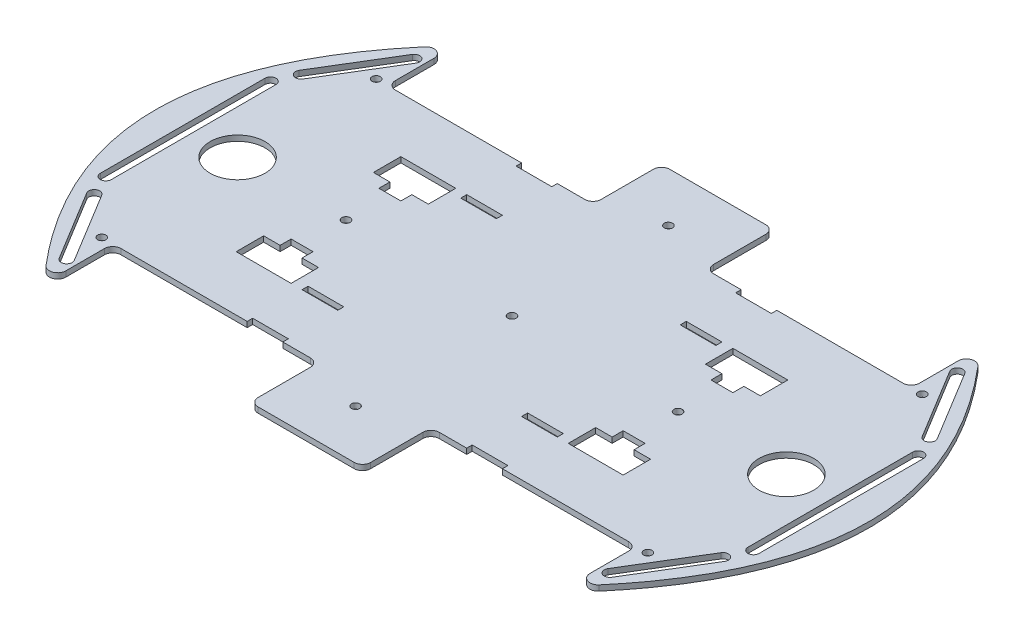
from build123d import *

# Parameters (mm, degrees)
SKETCH1_R           = 1.5
SKETCH1_W           = 13
SKETCH1_H           = 2.19615452
SKETCH1_R_2         = 10
BOSS_EXTRUDE1_DEPTH = 2
FILLET1_R           = 3


with BuildPart() as part:
    # Sketch1 → Boss-Extrude1 (new body)
    with BuildSketch(Plane(origin=(0, 0, 0), x_dir=(1, 0, 0), z_dir=(0, 1, 0))):
        with BuildLine():
            Line((-95.5, 69), (-95.5, 75))
            add(Edge.make_bspline(
                [(-95.5, 75), (-129.999999581, 37.500000455), (-130, 9.1e-07)],
                knots=[0, 0, 0, 0.499999994, 0.499999994, 0.499999994], degree=2))
            add(Edge.make_bspline(
                [(-130, 9.1e-07), (-130.000000419, -37.499999545), (-95.5, -75)],
                knots=[0.499999994, 0.499999994, 0.499999994, 1, 1, 1], degree=2))
            Line((-95.5, -75), (-95.5, -50))
            Line((-95.5, -50), (-46.5, -50))
            Line((-46.5, -50), (-46.5, -48))
            Line((-46.5, -48), (-33.5, -48))
            Line((-33.5, -48), (-33.5, -50))
            Line((-33.5, -50), (-20.5, -50))
            Line((-20.5, -50), (-20.5, -75))
            Line((-20.5, -75), (20.5, -75))
            Line((20.5, -75), (20.5, -50))
            Line((20.5, -50), (33.5, -50))
            Line((33.5, -50), (33.5, -48))
            Line((33.5, -48), (46.5, -48))
            Line((46.5, -48), (46.5, -50))
            Line((46.5, -50), (95.5, -50))
            Line((95.5, -50), (95.5, -75))
            add(Edge.make_bspline(
                [(130, 5.22e-07), (130.00000024, -37.499999739), (95.5, -75)],
                knots=[0.499999997, 0.499999997, 0.499999997, 1, 1, 1], degree=2))
            add(Edge.make_bspline(
                [(95.5, 75), (129.99999976, 37.500000261), (130, 5.22e-07)],
                knots=[0, 0, 0, 0.499999997, 0.499999997, 0.499999997], degree=2))
            Line((95.5, 75), (95.5, 50))
            Line((95.5, 50), (46.5, 50))
            Line((46.5, 50), (46.5, 48))
            Line((46.5, 48), (33.5, 48))
            Line((33.5, 48), (33.5, 50))
            Line((33.5, 50), (20.5, 50))
            Line((20.5, 50), (20.5, 75))
            Line((20.5, 75), (0, 75))
            Line((0, 75), (-20.5, 75))
            Line((-20.5, 75), (-20.5, 50))
            Line((-20.5, 50), (-33.5, 50))
            Line((-33.5, 50), (-33.5, 48))
            Line((-33.5, 48), (-46.5, 48))
            Line((-46.5, 48), (-46.5, 50))
            Line((-46.5, 50), (-95.5, 50))
            Line((-95.5, 50), (-95.5, 69))
        make_face()
        with BuildLine():
            Line((-100.665133807, -64.355482792), (-116.252551949, -38.722839626))
            ThreePointArc((-116.252551949, -38.722839626), (-115.58287028, -35.974835539), (-112.834866193, -36.644517208))
            Line((-112.834866193, -36.644517208), (-97.247448051, -62.277160374))
            ThreePointArc((-97.247448051, -62.277160374), (-97.91712972, -65.025164461), (-100.665133807, -64.355482792))
        make_face(mode=Mode.SUBTRACT)
        with Locations((-99.5, -50)):
            Circle(SKETCH1_R, mode=Mode.SUBTRACT)
        with Locations((-40, -28.90192274)):
            Rectangle(SKETCH1_W, SKETCH1_H, mode=Mode.SUBTRACT)
        Polygon((-56.5, -16), (-56.5, -20), (-50.5, -20), (-50.5, -30), (-70.5, -30), (-70.5, -20), (-64.5, -20), (-64.5, -16), align=None, mode=Mode.SUBTRACT)
        with Locations((0, -57)):
            Circle(SKETCH1_R, mode=Mode.SUBTRACT)
        with Locations((99.5, -50)):
            Circle(SKETCH1_R, mode=Mode.SUBTRACT)
        with BuildLine():
            ThreePointArc((112.834866193, -36.644517208), (115.58287028, -35.974835539), (116.252551949, -38.722839626))
            Line((116.252551949, -38.722839626), (100.665133807, -64.355482792))
            ThreePointArc((100.665133807, -64.355482792), (97.91712972, -65.025164461), (97.247448051, -62.277160374))
            Line((97.247448051, -62.277160374), (112.834866193, -36.644517208))
        make_face(mode=Mode.SUBTRACT)
        with Locations((40, -28.90192274)):
            Rectangle(SKETCH1_W, SKETCH1_H, mode=Mode.SUBTRACT)
        Polygon((50.5, -30), (50.5, -20), (56.5, -20), (56.5, -16), (64.5, -16), (64.5, -20), (70.5, -20), (70.5, -30), align=None, mode=Mode.SUBTRACT)
        with BuildLine():
            ThreePointArc((-120, 30), (-119.414213562, 31.414213562), (-118, 32))
            ThreePointArc((-118, 32), (-116.585786438, 31.414213562), (-116, 30))
            Line((-116, 30), (-116, -30))
            ThreePointArc((-116, -30), (-118, -32), (-120, -30))
            Line((-120, -30), (-120, 30))
        make_face(mode=Mode.SUBTRACT)
        with Locations((-100, 0)):
            Circle(SKETCH1_R_2, mode=Mode.SUBTRACT)
        with Locations((-60.5, 0)):
            Circle(SKETCH1_R, mode=Mode.SUBTRACT)
        Polygon((-70.5, 30), (-50.5, 30), (-50.5, 20), (-56.5, 20), (-56.5, 16), (-64.5, 16), (-64.5, 20), (-70.5, 20), align=None, mode=Mode.SUBTRACT)
        with Locations((-40, 28.90192274)):
            Rectangle(SKETCH1_W, SKETCH1_H, mode=Mode.SUBTRACT)
        with BuildLine():
            ThreePointArc((-100.665133807, 64.355482792), (-99.429827378, 65.259453908), (-97.91712972, 65.025164461))
            ThreePointArc((-97.91712972, 65.025164461), (-97.013158604, 63.789858032), (-97.247448051, 62.277160374))
            Line((-97.247448051, 62.277160374), (-112.834866193, 36.644517208))
            ThreePointArc((-112.834866193, 36.644517208), (-114.070172622, 35.740546092), (-115.58287028, 35.974835539))
            ThreePointArc((-115.58287028, 35.974835539), (-116.486841396, 37.210141968), (-116.252551949, 38.722839626))
            Line((-116.252551949, 38.722839626), (-100.665133807, 64.355482792))
        make_face(mode=Mode.SUBTRACT)
        with Locations((-99.5, 50)):
            Circle(SKETCH1_R, mode=Mode.SUBTRACT)
        Circle(SKETCH1_R, mode=Mode.SUBTRACT)
        with Locations((60.5, 0)):
            Circle(SKETCH1_R, mode=Mode.SUBTRACT)
        Polygon((56.5, 16), (56.5, 20), (50.5, 20), (50.5, 30), (70.5, 30), (70.5, 20), (64.5, 20), (64.5, 16), align=None, mode=Mode.SUBTRACT)
        with Locations((40, 28.90192274)):
            Rectangle(SKETCH1_W, SKETCH1_H, mode=Mode.SUBTRACT)
        with Locations((100, 0)):
            Circle(SKETCH1_R_2, mode=Mode.SUBTRACT)
        with BuildLine():
            Line((116, -30), (116, 30))
            ThreePointArc((116, 30), (118, 32), (120, 30))
            Line((120, 30), (120, -30))
            ThreePointArc((120, -30), (118, -32), (116, -30))
        make_face(mode=Mode.SUBTRACT)
        with BuildLine():
            ThreePointArc((1.5, 57), (-1.060660172, 55.939339828), (0, 58.5))
            ThreePointArc((0, 58.5), (1.060660172, 58.060660172), (1.5, 57))
        make_face(mode=Mode.SUBTRACT)
        with Locations((99.5, 50)):
            Circle(SKETCH1_R, mode=Mode.SUBTRACT)
        with BuildLine():
            Line((100.665133807, 64.355482792), (116.252551949, 38.722839626))
            ThreePointArc((116.252551949, 38.722839626), (115.58287028, 35.974835539), (112.834866193, 36.644517208))
            Line((112.834866193, 36.644517208), (97.247448051, 62.277160374))
            ThreePointArc((97.247448051, 62.277160374), (97.91712972, 65.025164461), (100.665133807, 64.355482792))
        make_face(mode=Mode.SUBTRACT)
    extrude(amount=BOSS_EXTRUDE1_DEPTH)

    # Fillet1
    fillet1_edges = [part.edges().sort_by_distance(p)[0] for p in [
        (-20.5, 1, -50),
        (-20.5, 1, -75),
        (95.5, 1, -75),
        (20.5, 1, -75),
        (20.5, 1, -50),
        (95.5, 1, -50),
        (95.5, 1, 75),
        (95.5, 1, 50),
        (20.5, 1, 50),
        (20.5, 1, 75),
        (-20.5, 1, 75),
        (-20.5, 1, 50),
        (-95.5, 1, 50),
        (-95.5, 1, -50),
        (-95.5, 1, -75),
        (-95.5, 1, 75),
    ]]
    fillet(fillet1_edges, radius=FILLET1_R)


solid = part.part
